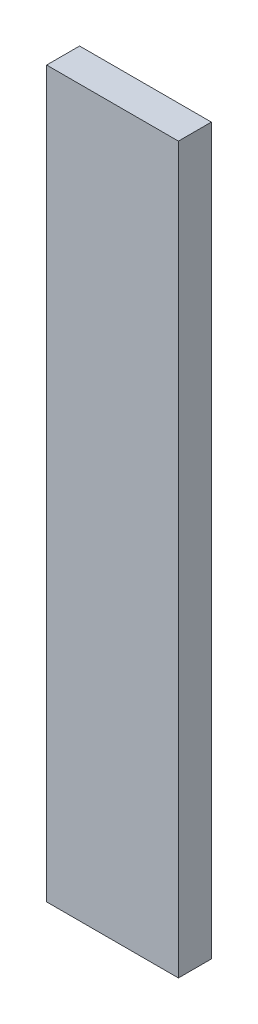
from build123d import *

# Parameters (mm, degrees)
SKETCH1_W           = 50.8
SKETCH1_H           = 279.4
BOSS_EXTRUDE1_DEPTH = 12.7


with BuildPart() as part:
    # Sketch1 → Boss-Extrude1 (new body)
    with BuildSketch(Plane.XY):
        with Locations((25.4, 139.7)):
            Rectangle(SKETCH1_W, SKETCH1_H)
    extrude(amount=BOSS_EXTRUDE1_DEPTH)


solid = part.part
